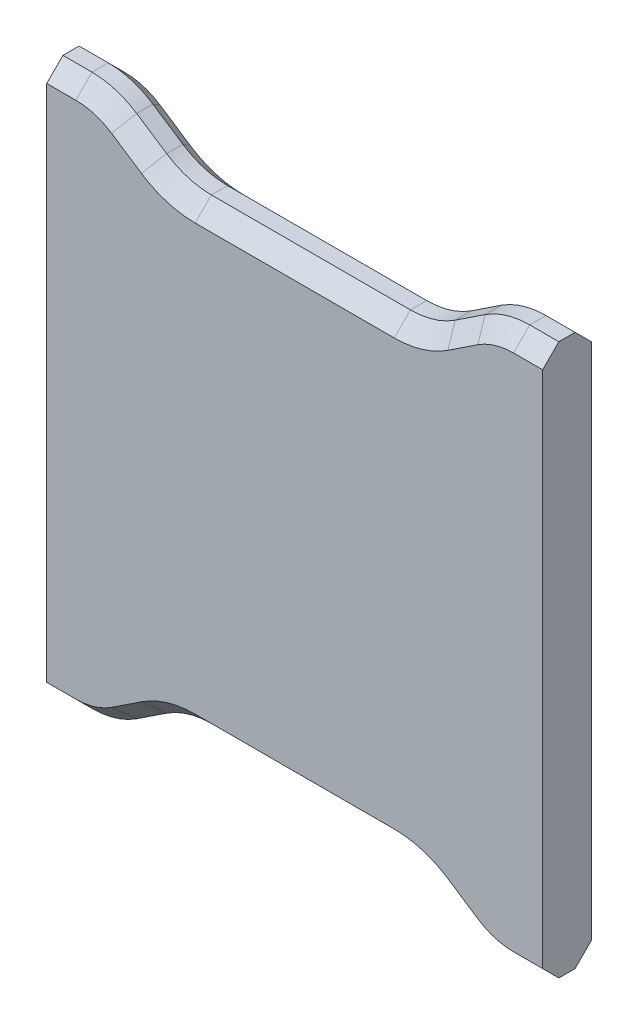
from build123d import *

# Parameters (mm, degrees)
CROQUIS1_W              = 61.2
CROQUIS1_H              = 68
SALIENTE_EXTRUIR1_DEPTH = 6
CORTAR_EXTRUIR1_DEPTH   = 47.134152209
REDONDEO1_R             = 10
CHAFL_N1_SIZE           = 2


with BuildPart() as part:
    # Croquis1 → Saliente-Extruir1 (new body)
    with BuildSketch(Plane.XY):
        Rectangle(CROQUIS1_W, CROQUIS1_H)
    extrude(amount=SALIENTE_EXTRUIR1_DEPTH)

    # Croquis2 → Cortar-Extruir1 (cut, through all)
    with BuildSketch(Plane.XY.offset(6)):
        Polygon((-24, 34), (-15.292264831, 28.240639048), (15.292264831, 28.240639048), (24, 34), align=None)
        Polygon((24, -34), (15.292264831, -28.240639048), (-15.292264831, -28.240639048), (-24, -34), align=None)
    extrude(amount=-CORTAR_EXTRUIR1_DEPTH, mode=Mode.SUBTRACT)

    # Redondeo1
    redondeo1_edges = [part.edges().sort_by_distance(p)[0] for p in [
        (-24, 34, 3),
        (24, 34, 3),
        (15.292264831, 28.240639048, 3),
        (-15.292264831, 28.240639048, 3),
        (24, -34, 3),
        (-24, -34, 3),
        (-15.292264831, -28.240639048, 3),
        (15.292264831, -28.240639048, 3),
    ]]
    fillet(redondeo1_edges, radius=REDONDEO1_R)

    # Chaflán1
    chafl_n1_edges = [part.edges().sort_by_distance(p)[0] for p in [
        (28.803922608, 34, 6),
        (19.646132416, -31.120319524, 6),
        (19.646132416, -31.120319524, 0),
        (19.646132416, 31.120319524, 6),
        (0, 28.240639048, 6),
        (28.803922608, 34, 0),
        (-19.646132416, 31.120319524, 6),
        (-28.803922608, 34, 6),
        (-19.646132416, -31.120319524, 6),
        (0, -28.240639048, 6),
        (28.803922608, -34, 6),
        (-24.127474692, 33.576192648, 6),
        (24.127474692, 33.576192648, 6),
        (-24.127474692, -33.576192648, 6),
        (24.127474692, -33.576192648, 6),
        (28.803922608, -34, 0),
        (0, 28.240639048, 0),
        (19.646132416, 31.120319524, 0),
        (0, -28.240639048, 0),
        (-28.803922608, -34, 0),
        (-19.646132416, -31.120319524, 0),
        (-28.803922608, 34, 0),
        (-19.646132416, 31.120319524, 0),
        (-24.127474692, 33.576192648, 0),
        (24.127474692, 33.576192648, 0),
        (-24.127474692, -33.576192648, 0),
        (24.127474692, -33.576192648, 0),
        (15.164790139, -28.6644464, 6),
        (15.164790139, -28.6644464, 0),
        (-15.164790139, -28.6644464, 6),
        (-15.164790139, -28.6644464, 0),
        (15.164790139, 28.6644464, 6),
        (15.164790139, 28.6644464, 0),
        (-15.164790139, 28.6644464, 6),
        (-15.164790139, 28.6644464, 0),
        (-28.803922608, -34, 6),
    ]]
    chamfer(chafl_n1_edges, length=CHAFL_N1_SIZE)


solid = part.part
